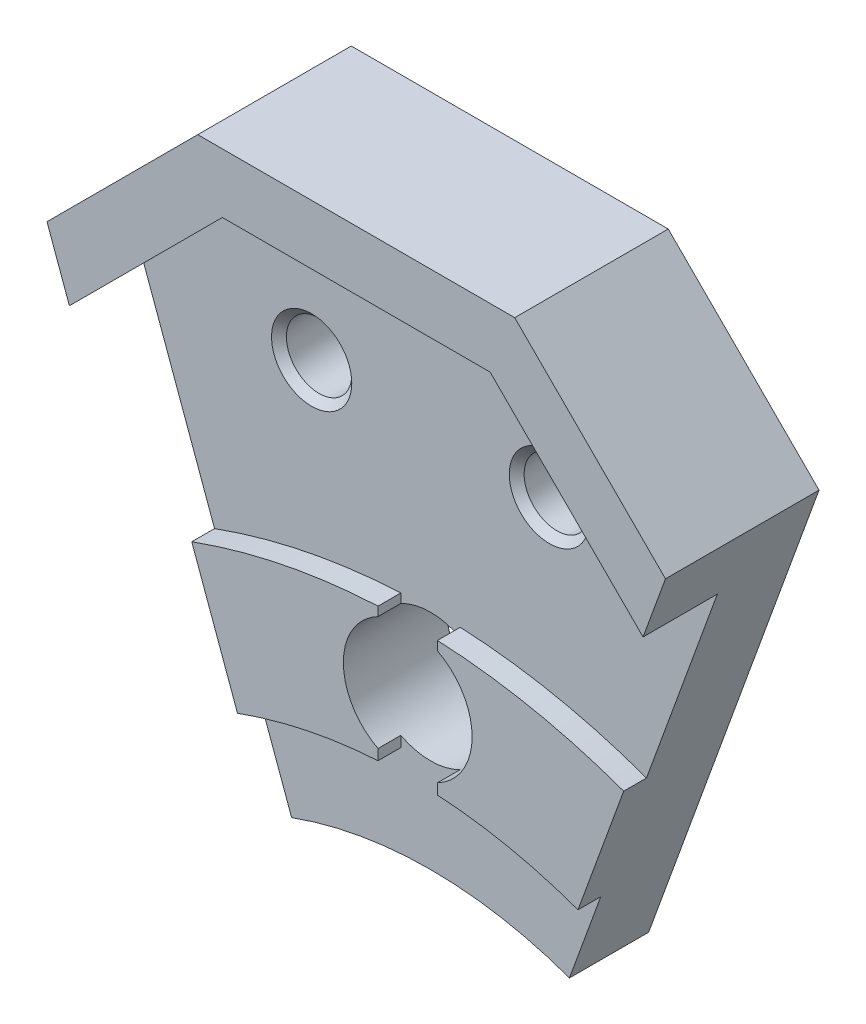
from build123d import *
from build123d.topology import SkipClean

# Parameters (mm, degrees)
ESQUISSE2_R                 = 3.25
BOSS_EXTRU_3_DEPTH          = 2
BOSS_EXTRU_4_DEPTH          = 3.75
BOSS_EXTRU_5_DEPTH          = 1.15
TROU_TARAUD_M43_D           = 3.3
TROU_TARAUD_M43_CSINK_D     = 4.05
TROU_TARAUD_M43_CSINK_ANGLE = 90


with BuildPart() as part:
    # Esquisse2 → Boss.-Extru.3 (new, symmetric)
    with BuildSketch(Plane.XY):
        with BuildLine():
            Line((-8, 50.5), (8, 50.5))
            Line((8, 50.5), (15.610501, 42.889499))
            Line((15.610501, 42.889499), (7.011413, 19.263699))
            ThreePointArc((7.011413, 19.263699), (0, 20.5), (-7.011413, 19.263699))
            Line((-7.011413, 19.263699), (-15.610501, 42.889499))
            Line((-15.610501, 42.889499), (-8, 50.5))
        make_face()
        with Locations((0, 28.5)):
            Circle(ESQUISSE2_R, mode=Mode.SUBTRACT)
    extrude(amount=BOSS_EXTRU_3_DEPTH, both=True)

    # Esquisse3 → Boss.-Extru.4 (add, symmetric)
    with BuildSketch(Plane.XY.offset(2)):
        Polygon((15.610501, 42.889499), (8, 50.5), (-8, 50.5), (-15.610501, 42.889499), (-14.478369, 39.778991), (-6.757359, 47.5), (6.757359, 47.5), (14.478369, 39.778991), align=None)
    extrude(amount=BOSS_EXTRU_4_DEPTH, both=True)

    # Esquisse4 → Boss.-Extru.5 (add, symmetric)
    with SkipClean():  # the faces are left unmerged after this step: merging them gives an invalid solid
        with BuildSketch(Plane.XY.offset(2)):
            with BuildLine():
                Line((8.593256, 23.609777), (10.901892, 29.952702))
                ThreePointArc((10.901892, 29.952702), (6.272313, 31.251779), (1.5, 31.839686))
                Line((1.5, 31.839686), (1.5, 31.383141))
                ThreePointArc((1.5, 31.383141), (3.25, 28.5), (1.5, 25.616859))
                Line((1.5, 25.616859), (1.5, 25.080184))
                ThreePointArc((1.5, 25.080184), (5.0999, 24.601964), (8.593256, 23.609777))
            make_face()
            with BuildLine():
                Line((-10.901892, 29.952702), (-8.593256, 23.609777))
                ThreePointArc((-8.593256, 23.609777), (-5.0999, 24.601964), (-1.5, 25.080184))
                Line((-1.5, 25.080184), (-1.5, 25.616859))
                ThreePointArc((-1.5, 25.616859), (-3.25, 28.5), (-1.5, 31.383141))
                Line((-1.5, 31.383141), (-1.5, 31.839686))
                ThreePointArc((-1.5, 31.839686), (-6.272313, 31.251779), (-10.901892, 29.952702))
            make_face()
        extrude(amount=BOSS_EXTRU_5_DEPTH, both=True)

    # Trou taraudé M43 (through all)
    with Locations(Plane.XY.offset(2)):
        with Locations((-6, 39.772078), (6, 39.772078)):
            CounterSinkHole(TROU_TARAUD_M43_D / 2, TROU_TARAUD_M43_CSINK_D / 2, counter_sink_angle=TROU_TARAUD_M43_CSINK_ANGLE)


solid = part.part
